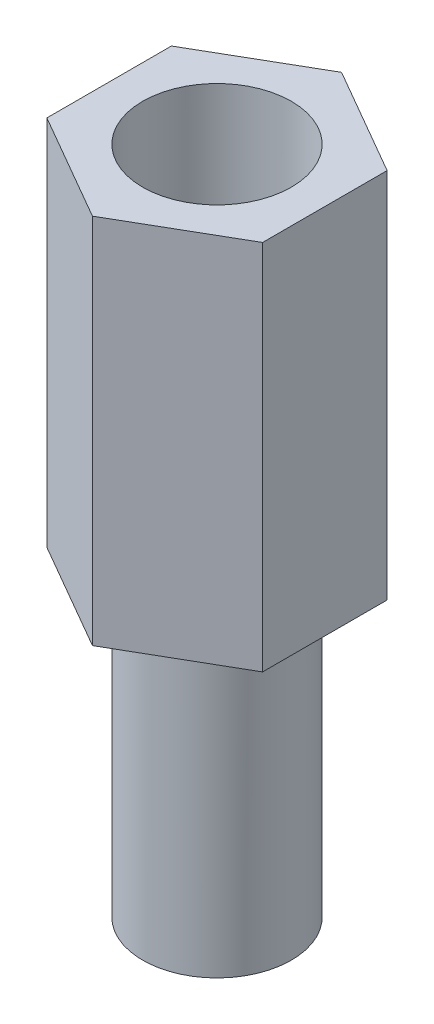
from build123d import *

# Parameters (mm, degrees)
SKETCH_1_R           = 1
EXTRUDE_1_DEPTH      = 5
EXTRUDE_2_DEPTH      = 4
EXTRUDE_2_DEPTH_BACK = 2
SKETCH_2_R           = 1


with BuildPart() as part:
    # 草图1 → 凸台-拉伸1 (new body)
    with BuildSketch(Plane(origin=(0, 0, 0), x_dir=(1, 0, 0), z_dir=(0, 1, 0))):
        Polygon((0, 1.674315781), (-1.45, 0.83715789), (-1.45, -0.83715789), (0, -1.674315781), (1.45, -0.83715789), (1.45, 0.83715789), align=None)
        with Locations(Location((0, 0, 0), (0, 0, 270))):
            Circle(SKETCH_1_R, mode=Mode.SUBTRACT)
    extrude(amount=EXTRUDE_1_DEPTH)

    # 草图2 → 凸台-拉伸2 (add, two sides: drawn at the far end of the back side and taken through both)
    with BuildSketch(Plane.XZ.offset(-EXTRUDE_2_DEPTH_BACK)):
        with Locations(Location((0, 0, 0), (0, 0, 270))):
            Circle(SKETCH_2_R)
    extrude(amount=EXTRUDE_2_DEPTH + EXTRUDE_2_DEPTH_BACK)


solid = part.part
